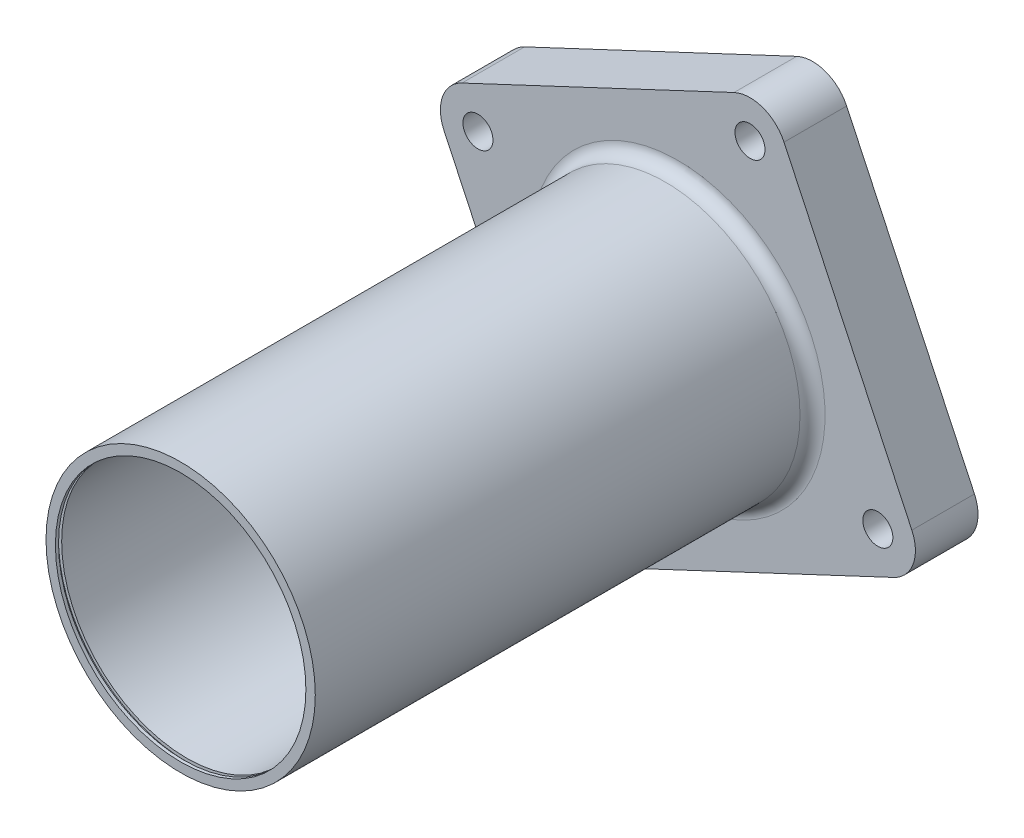
from build123d import *

# Parameters (mm, degrees)
SKETCH1_R                                   = 107.5
SKETCH1_R_2                                 = 100
BOSS_EXTRUDE1_DEPTH                         = 187
BOSS_EXTRUDE2_DEPTH                         = 30
BOSS_EXTRUDE3_DEPTH                         = 20
FILLET1_R                                   = 30
FILLET2_R                                   = 10
SKETCH5_R                                   = 105
CUT_EXTRUDE1_DEPTH                          = 942
SKETCH6_R                                   = 107.5
BOSS_EXTRUDE6_DEPTH                         = 10
SKETCH7_R                                   = 107.5
SKETCH7_R_2                                 = 100
BOSS_EXTRUDE7_DEPTH                         = 200
SKETCH8_R                                   = 102.5
SKETCH8_R_2                                 = 95
BOSS_EXTRUDE8_DEPTH                         = 4
CUT_EXTRUDE2_START                          = -2.5
SKETCH9_R                                   = 102.5
CUT_EXTRUDE2_DEPTH                          = 2.5
SKETCH10_R                                  = 31
CUT_EXTRUDE3_DEPTH                          = 28
CBORE_FOR_M4_HEX_HEAD_CAP_SCREW1_AT_2_COUNT = 2
CBORE_FOR_M4_HEX_HEAD_CAP_SCREW1_AT_2_PITCH = 53.575680531
CBORE_FOR_M4_HEX_HEAD_CAP_SCREW1_AT_3_COUNT = 2
CBORE_FOR_M4_HEX_HEAD_CAP_SCREW1_AT_3_PITCH = 98.994949366
CBORE_FOR_M4_HEX_HEAD_CAP_SCREW1_AT_4_COUNT = 2
CBORE_FOR_M4_HEX_HEAD_CAP_SCREW1_AT_4_PITCH = 129.343134552
CBORE_FOR_M4_HEX_HEAD_CAP_SCREW1_AT_5_COUNT = 2
CBORE_FOR_M4_HEX_HEAD_CAP_SCREW1_AT_5_PITCH = 140
CBORE_FOR_M4_HEX_HEAD_CAP_SCREW1_AT_6_COUNT = 2
CBORE_FOR_M4_HEX_HEAD_CAP_SCREW1_AT_6_PITCH = 129.343134552
CBORE_FOR_M4_HEX_HEAD_CAP_SCREW1_AT_7_COUNT = 2
CBORE_FOR_M4_HEX_HEAD_CAP_SCREW1_AT_7_PITCH = 98.994949366
CBORE_FOR_M4_HEX_HEAD_CAP_SCREW1_AT_8_COUNT = 2
CBORE_FOR_M4_HEX_HEAD_CAP_SCREW1_AT_8_PITCH = 53.575680531
CBORE_FOR_M3_HEX_HEAD_CAP_SCREW1_AT_2_COUNT = 2
CBORE_FOR_M3_HEX_HEAD_CAP_SCREW1_AT_2_PITCH = 32.145408414
CBORE_FOR_M3_HEX_HEAD_CAP_SCREW1_AT_3_COUNT = 2
CBORE_FOR_M3_HEX_HEAD_CAP_SCREW1_AT_3_PITCH = 59.396969796
CBORE_FOR_M3_HEX_HEAD_CAP_SCREW1_AT_4_COUNT = 2
CBORE_FOR_M3_HEX_HEAD_CAP_SCREW1_AT_4_PITCH = 77.605880961
CBORE_FOR_M3_HEX_HEAD_CAP_SCREW1_AT_5_COUNT = 2
CBORE_FOR_M3_HEX_HEAD_CAP_SCREW1_AT_5_PITCH = 84.00000025
CBORE_FOR_M3_HEX_HEAD_CAP_SCREW1_AT_6_COUNT = 2
CBORE_FOR_M3_HEX_HEAD_CAP_SCREW1_AT_6_PITCH = 77.605880961
CBORE_FOR_M3_HEX_HEAD_CAP_SCREW1_AT_7_COUNT = 2
CBORE_FOR_M3_HEX_HEAD_CAP_SCREW1_AT_7_PITCH = 59.396969796
CBORE_FOR_M3_HEX_HEAD_CAP_SCREW1_AT_8_COUNT = 2
CBORE_FOR_M3_HEX_HEAD_CAP_SCREW1_AT_8_PITCH = 32.145408414
BOSS_EXTRUDE9_START                         = 237
SKETCH20_R                                  = 105
SKETCH20_R_2                                = 90
BOSS_EXTRUDE9_DEPTH                         = 237
SKETCH21_R                                  = 12
CUT_EXTRUDE4_DEPTH                          = 421


with BuildPart() as part:
    # Sketch1 → Boss-Extrude1 (new body)
    with BuildSketch(Plane.XY):
        Circle(SKETCH1_R)
        Circle(SKETCH1_R_2, mode=Mode.SUBTRACT)
    extrude(amount=BOSS_EXTRUDE1_DEPTH)

    # Sketch2 → Boss-Extrude2 (add)
    with BuildSketch(Plane(origin=(0, 0, 0), x_dir=(-1, 0, 0), z_dir=(0, 0, -1))):
        Polygon((-199.547059231, -71.978963263), (-71.978963263, 199.547059231), (63.784047984, 135.763011247), (199.547059231, 71.978963263), (71.978963263, -199.547059231), (-63.784047984, -135.763011247), align=None)
    extrude(amount=BOSS_EXTRUDE2_DEPTH)

    # Sketch3 → Boss-Extrude3 (add)
    with BuildSketch(Plane(origin=(0, 0, -30), x_dir=(-1, 0, 0), z_dir=(0, 0, -1))):
        Polygon((-199.547059231, -71.978963263), (71.978963263, -199.547059231), (199.547059231, 71.978963263), (-71.978963263, 199.547059231), align=None)
    extrude(amount=BOSS_EXTRUDE3_DEPTH)

    # Fillet1
    fillet1_edges = [part.edges().sort_by_distance(p)[0] for p in [
        (199.547059231, -71.978963263, -25),
        (-71.978963263, -199.547059231, -25),
        (-199.547059231, 71.978963263, -25),
        (71.978963263, 199.547059231, -25),
    ]]
    fillet(fillet1_edges, radius=FILLET1_R)

    # Fillet2
    fillet2_edges = [part.edges().sort_by_distance(p)[0] for p in [
        (-107.5, 0, 0),
    ]]
    fillet(fillet2_edges, radius=FILLET2_R)

    # Sketch5 → Cut-Extrude1 (cut)
    with BuildSketch(Plane(origin=(0, 0, -50), x_dir=(-1, 0, 0), z_dir=(0, 0, -1))):
        Circle(SKETCH5_R)
    extrude(amount=-CUT_EXTRUDE1_DEPTH, mode=Mode.SUBTRACT)

    # Sketch6 → Boss-Extrude6 (add)
    with BuildSketch(Plane.XY.offset(187)):
        with Locations(Location((0, 0, 0), (0, 0, 180))):
            Circle(SKETCH6_R)
    extrude(amount=BOSS_EXTRUDE6_DEPTH)

    # Sketch7 → Boss-Extrude7 (add)
    with BuildSketch(Plane.XY.offset(197)):
        with Locations(Location((0, 0, 0), (0, 0, 180))):
            Circle(SKETCH7_R)
        Circle(SKETCH7_R_2, mode=Mode.SUBTRACT)
    extrude(amount=BOSS_EXTRUDE7_DEPTH)

    # Sketch8 → Boss-Extrude8 (add)
    with BuildSketch(Plane.XY.offset(197)):
        Circle(SKETCH8_R)
        Circle(SKETCH8_R_2, mode=Mode.SUBTRACT)
    extrude(amount=BOSS_EXTRUDE8_DEPTH)

    # Sketch9 → Cut-Extrude2 (cut)
    with BuildSketch(Plane.XY.offset(397).offset(CUT_EXTRUDE2_START)):
        Circle(SKETCH9_R)
    extrude(amount=-CUT_EXTRUDE2_DEPTH, mode=Mode.SUBTRACT)

    # Sketch10 → Cut-Extrude3 (cut)
    with BuildSketch(Plane(origin=(0, 0, 187), x_dir=(-1, 0, 0), z_dir=(0, 0, -1))):
        Circle(SKETCH10_R)
    extrude(amount=-CUT_EXTRUDE3_DEPTH, mode=Mode.SUBTRACT)

    # Sketch13 → CBORE for M4 Hex Head Cap Screw1 (revolve, cut)
    with BuildSketch(Plane(origin=(23.75184564, 65.847170241, 197), x_dir=(0, -1, 0), z_dir=(1, 0, 0))):
        Polygon((0, 0), (0, 11.351936393), (2.25, 10), (2.25, 2.8), (5.5415, 2.8), (5.5415, 0.025), (5.5665, 0), align=None)
    cbore_for_m4_hex_head_cap_screw1 = revolve(axis=Axis((23.75184564, 65.847170241, 203.35), (0, 0, -1)), mode=Mode.SUBTRACT)

    # CBORE for M4 Hex Head Cap Screw1 at 2: CBORE for M4 Hex Head Cap Screw1 ×2
    with Locations(*[Vector(0.7392202149258387, -0.6734637880725266, 0) * (i * CBORE_FOR_M4_HEX_HEAD_CAP_SCREW1_AT_2_PITCH) for i in range(1, CBORE_FOR_M4_HEX_HEAD_CAP_SCREW1_AT_2_COUNT)]):
        add(cbore_for_m4_hex_head_cap_screw1, mode=Mode.SUBTRACT)

    # CBORE for M4 Hex Head Cap Screw1 at 3: CBORE for M4 Hex Head Cap Screw1 ×2
    with Locations(*[Vector(0.4252269925953868, -0.9050867388092054, 0) * (i * CBORE_FOR_M4_HEX_HEAD_CAP_SCREW1_AT_3_PITCH) for i in range(1, CBORE_FOR_M4_HEX_HEAD_CAP_SCREW1_AT_3_COUNT)]):
        add(cbore_for_m4_hex_head_cap_screw1, mode=Mode.SUBTRACT)

    # CBORE for M4 Hex Head Cap Screw1 at 4: CBORE for M4 Hex Head Cap Screw1 ×2
    with Locations(*[Vector(0.04649681533457415, -0.998918438193901, 0) * (i * CBORE_FOR_M4_HEX_HEAD_CAP_SCREW1_AT_4_PITCH) for i in range(1, CBORE_FOR_M4_HEX_HEAD_CAP_SCREW1_AT_4_COUNT)]):
        add(cbore_for_m4_hex_head_cap_screw1, mode=Mode.SUBTRACT)

    # CBORE for M4 Hex Head Cap Screw1 at 5: CBORE for M4 Hex Head Cap Screw1 ×2
    with Locations(*[Vector(-0.3393120805662469, -0.9406738605817666, 0) * (i * CBORE_FOR_M4_HEX_HEAD_CAP_SCREW1_AT_5_PITCH) for i in range(1, CBORE_FOR_M4_HEX_HEAD_CAP_SCREW1_AT_5_COUNT)]):
        add(cbore_for_m4_hex_head_cap_screw1, mode=Mode.SUBTRACT)

    # CBORE for M4 Hex Head Cap Screw1 at 6: CBORE for M4 Hex Head Cap Screw1 ×2
    with Locations(*[Vector(-0.6734637880725266, -0.7392202149258387, 0) * (i * CBORE_FOR_M4_HEX_HEAD_CAP_SCREW1_AT_6_PITCH) for i in range(1, CBORE_FOR_M4_HEX_HEAD_CAP_SCREW1_AT_6_COUNT)]):
        add(cbore_for_m4_hex_head_cap_screw1, mode=Mode.SUBTRACT)

    # CBORE for M4 Hex Head Cap Screw1 at 7: CBORE for M4 Hex Head Cap Screw1 ×2
    with Locations(*[Vector(-0.9050867388092054, -0.4252269925953869, 0) * (i * CBORE_FOR_M4_HEX_HEAD_CAP_SCREW1_AT_7_PITCH) for i in range(1, CBORE_FOR_M4_HEX_HEAD_CAP_SCREW1_AT_7_COUNT)]):
        add(cbore_for_m4_hex_head_cap_screw1, mode=Mode.SUBTRACT)

    # CBORE for M4 Hex Head Cap Screw1 at 8: CBORE for M4 Hex Head Cap Screw1 ×2
    with Locations(*[Vector(-0.9989184381939011, -0.046496815334574164, 0) * (i * CBORE_FOR_M4_HEX_HEAD_CAP_SCREW1_AT_8_PITCH) for i in range(1, CBORE_FOR_M4_HEX_HEAD_CAP_SCREW1_AT_8_COUNT)]):
        add(cbore_for_m4_hex_head_cap_screw1, mode=Mode.SUBTRACT)

    # Sketch19 → CBORE for M3 Hex Head Cap Screw1 (revolve, cut)
    with BuildSketch(Plane(origin=(14.251107426, 39.508302262, 197), x_dir=(0, -1, 0), z_dir=(1, 0, 0))):
        Polygon((0, 0), (0, 11.021463052), (1.7, 10), (1.7, 2), (4.6755, 2), (4.6755, 0.025), (4.7005, 0), align=None)
    cbore_for_m3_hex_head_cap_screw1 = revolve(axis=Axis((14.251107426, 39.508302262, 203.35), (0, 0, -1)), mode=Mode.SUBTRACT)

    # CBORE for M3 Hex Head Cap Screw1 at 2: CBORE for M3 Hex Head Cap Screw1 ×2
    with Locations(*[Vector(0.7392202149258387, -0.6734637880725266, 0) * (i * CBORE_FOR_M3_HEX_HEAD_CAP_SCREW1_AT_2_PITCH) for i in range(1, CBORE_FOR_M3_HEX_HEAD_CAP_SCREW1_AT_2_COUNT)]):
        add(cbore_for_m3_hex_head_cap_screw1, mode=Mode.SUBTRACT)

    # CBORE for M3 Hex Head Cap Screw1 at 3: CBORE for M3 Hex Head Cap Screw1 ×2
    with Locations(*[Vector(0.4252269925953868, -0.9050867388092055, 0) * (i * CBORE_FOR_M3_HEX_HEAD_CAP_SCREW1_AT_3_PITCH) for i in range(1, CBORE_FOR_M3_HEX_HEAD_CAP_SCREW1_AT_3_COUNT)]):
        add(cbore_for_m3_hex_head_cap_screw1, mode=Mode.SUBTRACT)

    # CBORE for M3 Hex Head Cap Screw1 at 4: CBORE for M3 Hex Head Cap Screw1 ×2
    with Locations(*[Vector(0.0464968153345742, -0.9989184381939011, 0) * (i * CBORE_FOR_M3_HEX_HEAD_CAP_SCREW1_AT_4_PITCH) for i in range(1, CBORE_FOR_M3_HEX_HEAD_CAP_SCREW1_AT_4_COUNT)]):
        add(cbore_for_m3_hex_head_cap_screw1, mode=Mode.SUBTRACT)

    # CBORE for M3 Hex Head Cap Screw1 at 5: CBORE for M3 Hex Head Cap Screw1 ×2
    with Locations(*[Vector(-0.3393120805662469, -0.9406738605817666, 0) * (i * CBORE_FOR_M3_HEX_HEAD_CAP_SCREW1_AT_5_PITCH) for i in range(1, CBORE_FOR_M3_HEX_HEAD_CAP_SCREW1_AT_5_COUNT)]):
        add(cbore_for_m3_hex_head_cap_screw1, mode=Mode.SUBTRACT)

    # CBORE for M3 Hex Head Cap Screw1 at 6: CBORE for M3 Hex Head Cap Screw1 ×2
    with Locations(*[Vector(-0.6734637880725266, -0.7392202149258387, 0) * (i * CBORE_FOR_M3_HEX_HEAD_CAP_SCREW1_AT_6_PITCH) for i in range(1, CBORE_FOR_M3_HEX_HEAD_CAP_SCREW1_AT_6_COUNT)]):
        add(cbore_for_m3_hex_head_cap_screw1, mode=Mode.SUBTRACT)

    # CBORE for M3 Hex Head Cap Screw1 at 7: CBORE for M3 Hex Head Cap Screw1 ×2
    with Locations(*[Vector(-0.9050867388092054, -0.4252269925953869, 0) * (i * CBORE_FOR_M3_HEX_HEAD_CAP_SCREW1_AT_7_PITCH) for i in range(1, CBORE_FOR_M3_HEX_HEAD_CAP_SCREW1_AT_7_COUNT)]):
        add(cbore_for_m3_hex_head_cap_screw1, mode=Mode.SUBTRACT)

    # CBORE for M3 Hex Head Cap Screw1 at 8: CBORE for M3 Hex Head Cap Screw1 ×2
    with Locations(*[Vector(-0.998918438193901, -0.046496815334574004, 0) * (i * CBORE_FOR_M3_HEX_HEAD_CAP_SCREW1_AT_8_PITCH) for i in range(1, CBORE_FOR_M3_HEX_HEAD_CAP_SCREW1_AT_8_COUNT)]):
        add(cbore_for_m3_hex_head_cap_screw1, mode=Mode.SUBTRACT)

    # Sketch20 → Boss-Extrude9 (add)
    with BuildSketch(Plane(origin=(0, 0, 187), x_dir=(-1, 0, 0), z_dir=(0, 0, -1)).offset(BOSS_EXTRUDE9_START)):
        Circle(SKETCH20_R)
        Circle(SKETCH20_R_2, mode=Mode.SUBTRACT)
    extrude(amount=-BOSS_EXTRUDE9_DEPTH)

    # Sketch21 → Cut-Extrude4 (cut)
    with BuildSketch(Plane.XY):
        with Locations((-159.637647385, 57.58317061)):
            Circle(SKETCH21_R)
        with Locations((57.58317061, 159.637647385)):
            Circle(SKETCH21_R)
        with Locations((159.637647385, -57.58317061)):
            Circle(SKETCH21_R)
        with Locations((-57.58317061, -159.637647385)):
            Circle(SKETCH21_R)
    extrude(amount=-CUT_EXTRUDE4_DEPTH, mode=Mode.SUBTRACT)


solid = part.part
